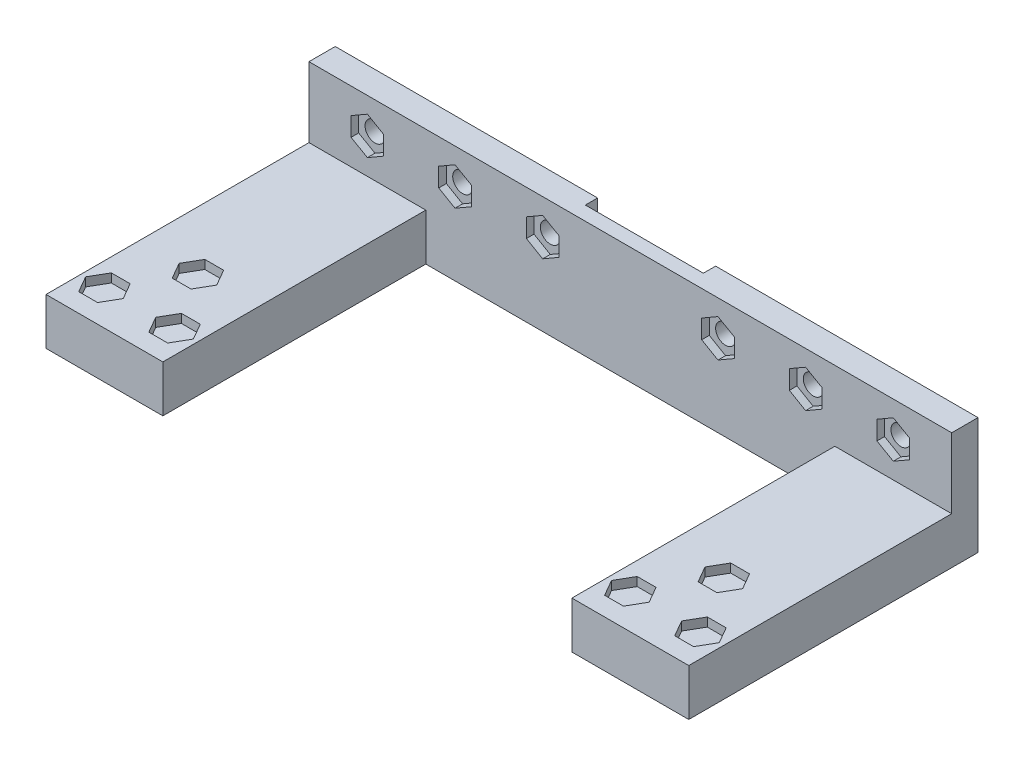
from build123d import *

# Parameters (mm, degrees)
SKETCH_1_W          = 110
SKETCH_1_H          = 20
SKETCH_1_R          = 1.7
EXTRUDE_1_DEPTH     = 4.5
SKETCH_2_W          = 20
SKETCH_2_H          = 8
EXTRUDE_2_DEPTH     = 45
CUT_EXTRUDE_1_DEPTH = 1.3
CUT_EXTRUDE_2_DEPTH = 29
SKETCH_11_R         = 1.7
CUT_EXTRUDE_3_DEPTH = 167
CUT_EXTRUDE_4_DEPTH = 1.5


with BuildPart() as part:
    # 草图1 → 凸台-拉伸1 (new body)
    with BuildSketch(Plane.XY):
        with Locations((0, 10)):
            Rectangle(SKETCH_1_W, SKETCH_1_H)
        with Locations((-45, 14)):
            Circle(SKETCH_1_R, mode=Mode.SUBTRACT)
        with Locations((-30, 14)):
            Circle(SKETCH_1_R, mode=Mode.SUBTRACT)
        with Locations((-15, 14)):
            Circle(SKETCH_1_R, mode=Mode.SUBTRACT)
        with Locations((15, 14)):
            Circle(SKETCH_1_R, mode=Mode.SUBTRACT)
        with Locations((30, 14)):
            Circle(SKETCH_1_R, mode=Mode.SUBTRACT)
        with Locations((45, 14)):
            Circle(SKETCH_1_R, mode=Mode.SUBTRACT)
    extrude(amount=EXTRUDE_1_DEPTH)

    # 草图2 → 凸台-拉伸2 (add)
    with BuildSketch(Plane.XY.offset(4.5)):
        with Locations((-45, 4)):
            Rectangle(SKETCH_2_W, SKETCH_2_H)
        with Locations((45, 4)):
            Rectangle(SKETCH_2_W, SKETCH_2_H)
    extrude(amount=EXTRUDE_2_DEPTH)

    # 草图3 → 切除-拉伸1 (cut)
    with BuildSketch(Plane.XY.offset(4.5)):
        Polygon((-45, 17.22), (-47.7886018, 15.61), (-47.7886018, 12.39), (-45, 10.78), (-42.2113982, 12.39), (-42.2113982, 15.61), align=None)
        Polygon((-30, 17.22), (-32.7886018, 15.61), (-32.7886018, 12.39), (-30, 10.78), (-27.2113982, 12.39), (-27.2113982, 15.61), align=None)
        Polygon((-15, 17.22), (-17.7886018, 15.61), (-17.7886018, 12.39), (-15, 10.78), (-12.2113982, 12.39), (-12.2113982, 15.61), align=None)
        Polygon((15, 17.22), (12.2113982, 15.61), (12.2113982, 12.39), (15, 10.78), (17.7886018, 12.39), (17.7886018, 15.61), align=None)
        Polygon((30, 17.22), (27.2113982, 15.61), (27.2113982, 12.39), (30, 10.78), (32.7886018, 12.39), (32.7886018, 15.61), align=None)
        Polygon((45, 17.22), (42.2113982, 15.61), (42.2113982, 12.39), (45, 10.78), (47.7886018, 12.39), (47.7886018, 15.61), align=None)
    extrude(amount=-CUT_EXTRUDE_1_DEPTH, mode=Mode.SUBTRACT)

    # 草图10 → 切除-拉伸2 (cut)
    with BuildSketch(Plane.XZ):
        Polygon((0, 0), (10.1, 0), (10.1, 2.1), (-10.1, 2.1), (-10.1, 0), align=None)
    extrude(amount=-CUT_EXTRUDE_2_DEPTH, mode=Mode.SUBTRACT)

    # 草图11 → 切除-拉伸3 (cut)
    with BuildSketch(Plane.XZ):
        with Locations((-331.768706014, -207.641629986)):
            Circle(SKETCH_11_R)
        with Locations((-337.768706014, -197.641629986)):
            Circle(SKETCH_11_R)
        with Locations((-325.768706014, -197.641629986)):
            Circle(SKETCH_11_R)
        with Locations((-247.768706014, -197.641629986)):
            Circle(SKETCH_11_R)
        with Locations((-235.768706014, -197.641629986)):
            Circle(SKETCH_11_R)
        with Locations((-241.768706014, -207.641629986)):
            Circle(SKETCH_11_R)
    extrude(amount=-CUT_EXTRUDE_3_DEPTH, mode=Mode.SUBTRACT)

    # 草图12 → 切除-拉伸4 (cut)
    with BuildSketch(Plane(origin=(0, 8, 0), x_dir=(1, 0, 0), z_dir=(0, 1, 0))):
        Polygon((-41.78, -33.5), (-43.39, -30.7113982), (-46.61, -30.7113982), (-48.22, -33.5), (-46.61, -36.2886018), (-43.39, -36.2886018), align=None)
        Polygon((-47.78, -43.5), (-49.39, -40.7113982), (-52.61, -40.7113982), (-54.22, -43.5), (-52.61, -46.2886018), (-49.39, -46.2886018), align=None)
        Polygon((-35.78, -43.5), (-37.39, -40.7113982), (-40.61, -40.7113982), (-42.22, -43.5), (-40.61, -46.2886018), (-37.39, -46.2886018), align=None)
        Polygon((37.39, -46.2886018), (35.78, -43.5), (37.39, -40.7113982), (40.61, -40.7113982), (42.22, -43.5), (40.61, -46.2886018), align=None)
        Polygon((49.39, -46.2886018), (47.78, -43.5), (49.39, -40.7113982), (52.61, -40.7113982), (54.22, -43.5), (52.61, -46.2886018), align=None)
        Polygon((43.39, -36.2886018), (41.78, -33.5), (43.39, -30.7113982), (46.61, -30.7113982), (48.22, -33.5), (46.61, -36.2886018), align=None)
    extrude(amount=-CUT_EXTRUDE_4_DEPTH, mode=Mode.SUBTRACT)


solid = part.part
